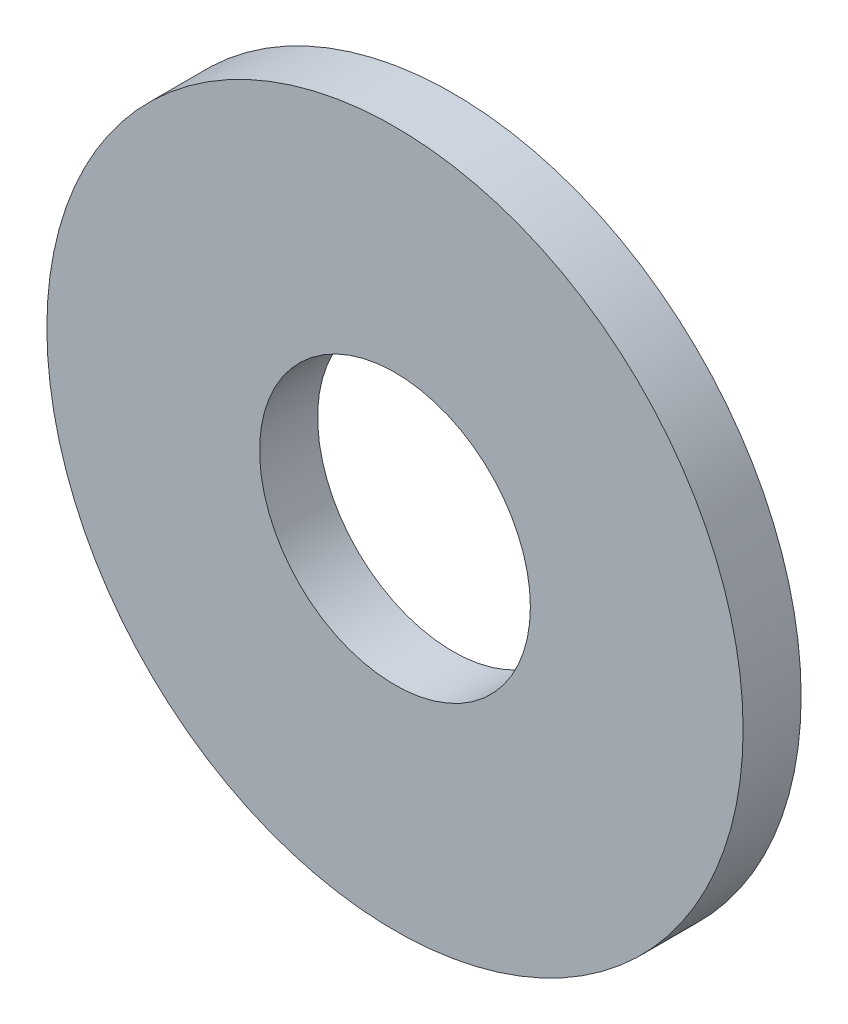
from build123d import *

# Parameters (mm, degrees)
SKETCH_1_R      = 9
SKETCH_1_R_2    = 3.5
EXTRUDE_1_DEPTH = 1.5


with BuildPart() as part:
    # Эскиз1 → Вытянуть1 (new body)
    with BuildSketch(Plane.XY):
        Circle(SKETCH_1_R)
        Circle(SKETCH_1_R_2, mode=Mode.SUBTRACT)
    extrude(amount=EXTRUDE_1_DEPTH)


solid = part.part
